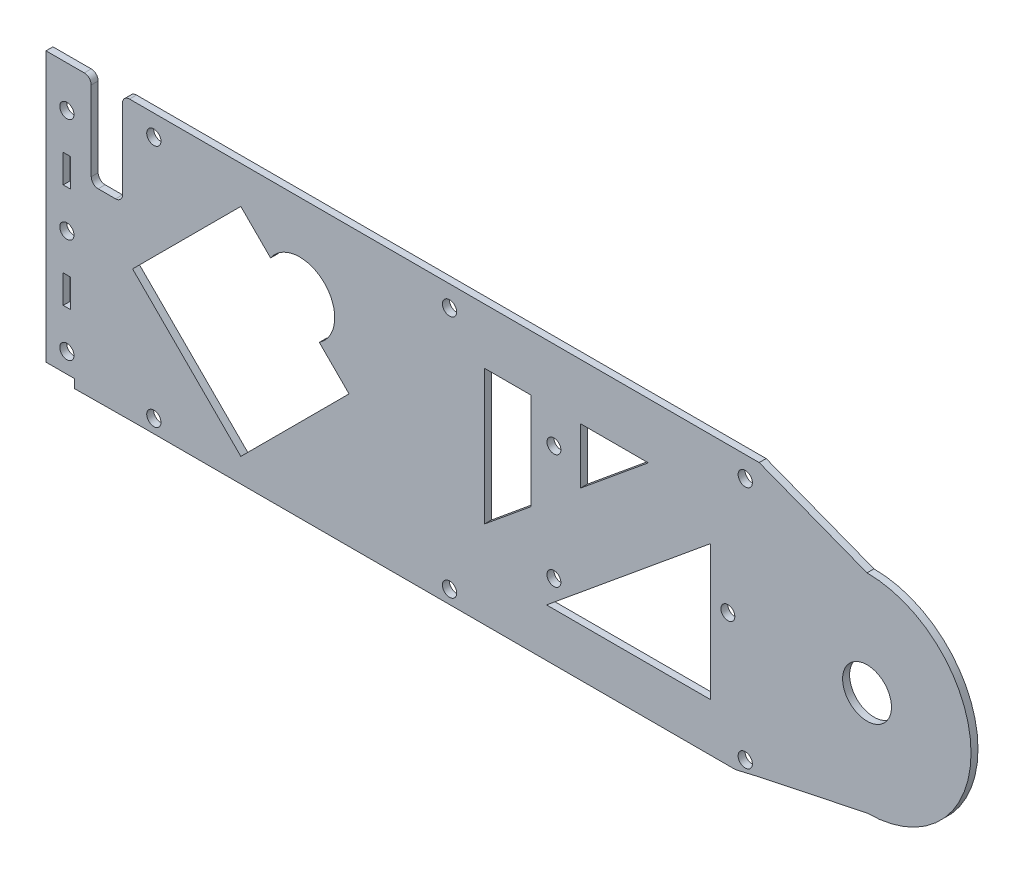
from build123d import *

# Parameters (mm, degrees)
SKETCH_1_R          = 2.05
SKETCH_1_R_2        = 7.02
SKETCH_1_W          = 2.1
SKETCH_1_H          = 8.1
EXTRUDE_1_DEPTH     = 2
FILLET_1_R          = 2
SKETCH_3_R          = 2.05
SKETCH_3_R_2        = 2
CUT_EXTRUDE_1_DEPTH = 2


with BuildPart() as part:
    # 草图1 → 凸台-拉伸1 (new body)
    with BuildSketch(Plane.XY):
        with BuildLine():
            Line((230.542857143, -30.045714286), (199.556073527, -36.55591431))
            Line((199.556073527, -36.55591431), (192.746868021, -38.145714286))
            Line((192.746868021, -38.145714286), (21.365844759, -38.145714286))
            Line((21.365844759, -38.145714286), (2.692857143, -38.295714286))
            Line((2.692857143, -38.295714286), (2.692857143, -35.802553436))
            Line((2.692857143, -35.802553436), (-5.457142857, -35.802553436))
            Line((-5.457142857, -35.802553436), (-5.457142857, 41.704285714))
            Line((-5.457142857, 41.704285714), (7.542857143, 41.704285714))
            Line((7.542857143, 41.704285714), (7.542857143, 14.854285714))
            Line((7.542857143, 14.854285714), (16.542857143, 14.854285714))
            Line((16.542857143, 14.854285714), (16.542857143, 41.704285714))
            Line((16.542857143, 41.704285714), (199.542857143, 41.704285714))
            Line((199.542857143, 41.704285714), (230.542857143, 29.754285714))
            ThreePointArc((230.542857143, 29.754285714), (260.442857143, -0.145714286), (230.542857143, -30.045714286))
        make_face()
        with Locations((0.542857143, 29.854285714)):
            Circle(SKETCH_1_R, mode=Mode.SUBTRACT)
        with Locations((0.542857143, -0.145714286)):
            Circle(SKETCH_1_R, mode=Mode.SUBTRACT)
        with Locations((0.542857143, -30.145714286)):
            Circle(SKETCH_1_R, mode=Mode.SUBTRACT)
        with Locations((230.542857143, -0.145714286)):
            Circle(SKETCH_1_R_2, mode=Mode.SUBTRACT)
        with Locations((0.542857143, 14.854285714)):
            Rectangle(SKETCH_1_W, SKETCH_1_H, mode=Mode.SUBTRACT)
        with BuildLine():
            Line((59.099206329, 22.4106349), (50.542857143, 30.966984086))
            Line((50.542857143, 30.966984086), (19.430158771, -0.145714286))
            Line((19.430158771, -0.145714286), (50.542857143, -31.258412658))
            Line((50.542857143, -31.258412658), (81.655555515, -0.145714286))
            Line((81.655555515, -0.145714286), (73.099206329, 8.4106349))
            ThreePointArc((73.099206329, 8.4106349), (74.584487703, 23.895916275), (59.099206329, 22.4106349))
        make_face(mode=Mode.SUBTRACT)
        with Locations((0.542857143, -15.145714286)):
            Rectangle(SKETCH_1_W, SKETCH_1_H, mode=Mode.SUBTRACT)
    extrude(amount=EXTRUDE_1_DEPTH)

    # 圆角1
    fillet_1_edges = [part.edges().sort_by_distance(p)[0] for p in [
        (7.542857143, 41.704285714, 1),
        (7.542857143, 14.854285714, 1),
        (16.542857143, 14.854285714, 1),
        (16.542857143, 41.704285714, 1),
    ]]
    fillet(fillet_1_edges, radius=FILLET_1_R)

    # 草图3 → 切除-拉伸1 (cut)
    with BuildSketch(Plane.XY.offset(2)):
        with Locations((25.542857143, 35.704285714)):
            Circle(SKETCH_3_R)
        with Locations((110.542857143, 35.704285714)):
            Circle(SKETCH_3_R)
        with Locations((195.542857143, 35.704285714)):
            Circle(SKETCH_3_R)
        with Locations((110.542857143, -34.295714286)):
            Circle(SKETCH_3_R)
        with Locations((195.542857143, -34.295714286)):
            Circle(SKETCH_3_R)
        with Locations((25.542857143, -34.295714286)):
            Circle(SKETCH_3_R)
        with Locations((190.542857143, -0.145714286)):
            Circle(SKETCH_3_R_2)
        with Locations((140.542857143, 16.354285714)):
            Circle(SKETCH_3_R_2)
        with Locations(Location((140.542857143, -16.645714286, 0), (0, 0, 180))):
            Circle(SKETCH_3_R_2)
        Polygon((148.153334198, 25.704285714), (148.153334198, 9.632158315), (167.669488896, 25.704285714), align=None)
        Polygon((185.542857143, -24.295714286), (138.41622539, -24.295714286), (185.542857143, 14.51445304), align=None)
        Polygon((120.542857143, -13.105881612), (120.542857143, 25.704285714), (134.014872528, 25.704285714), (134.014872528, -2.011280706), align=None)
    extrude(amount=-CUT_EXTRUDE_1_DEPTH, mode=Mode.SUBTRACT)


solid = part.part
